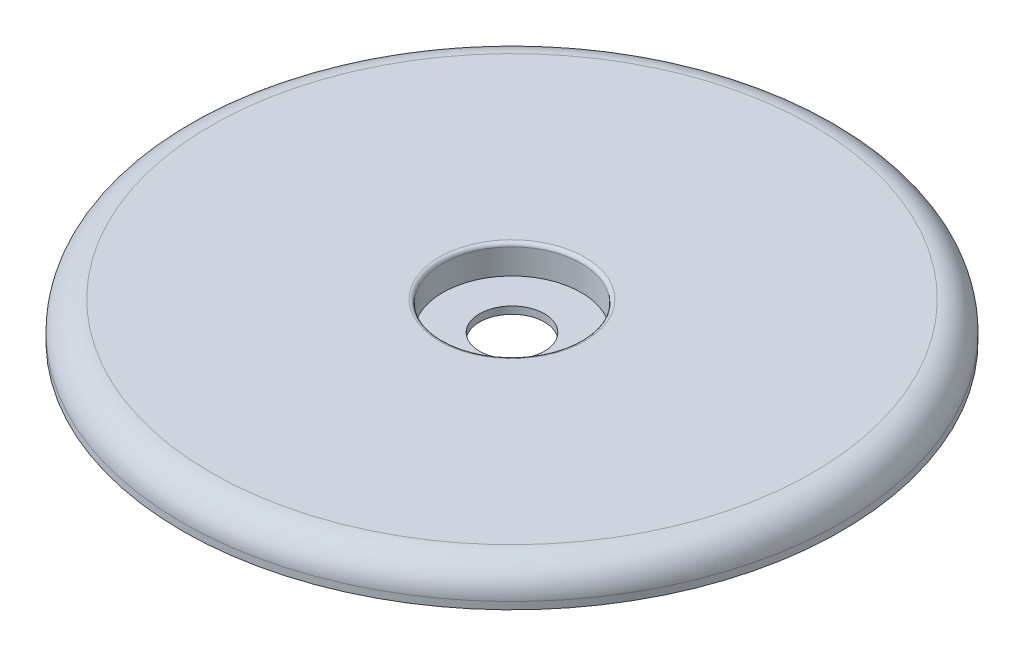
from build123d import *

# Parameters (mm, degrees)
SKETCH1_R           = 45.72
BOSS_EXTRUDE1_DEPTH = 5
SKETCH2_R           = 9.6
SKETCH2_R_2         = 4.5
CUT_EXTRUDE1_DEPTH  = 4
SKETCH3_R           = 4.5
CUT_EXTRUDE2_DEPTH  = 65.781454136
FILLET1_R           = 4
FILLET2_R           = 0.5


with BuildPart() as part:
    # Sketch1 → Boss-Extrude1 (new body)
    with BuildSketch(Plane(origin=(0, 0, 0), x_dir=(1, 0, 0), z_dir=(0, 1, 0))):
        with Locations(Location((0, 0, 0), (0, 0, 270))):
            Circle(SKETCH1_R)
    extrude(amount=BOSS_EXTRUDE1_DEPTH)

    # Sketch2 → Cut-Extrude1 (cut)
    # profile 1 of 2: a face of its own
    with BuildSketch(Plane(origin=(0, 5, 0), x_dir=(1, 0, 0), z_dir=(0, 1, 0))):
        with Locations(Location((0, 0, 0), (0, 0, 270))):
            Circle(SKETCH2_R)
        Circle(SKETCH2_R_2, mode=Mode.SUBTRACT)
    # profile 2 of 2: a face of its own
    with BuildSketch(Plane(origin=(0, 5, 0), x_dir=(1, 0, 0), z_dir=(0, 1, 0))):
        Circle(SKETCH2_R_2)
    extrude(amount=-CUT_EXTRUDE1_DEPTH, mode=Mode.SUBTRACT)

    # Sketch3 → Cut-Extrude2 (cut, through all)
    with BuildSketch(Plane(origin=(0, 1, 0), x_dir=(1, 0, 0), z_dir=(0, 1, 0))):
        with Locations(Location((0, 0, 0), (0, 0, 270))):
            Circle(SKETCH3_R)
    extrude(amount=-CUT_EXTRUDE2_DEPTH, mode=Mode.SUBTRACT)

    # Fillet1
    fillet1_edges = [part.edges().sort_by_distance(p)[0] for p in [
        (0, 5, -45.72),
    ]]
    fillet(fillet1_edges, radius=FILLET1_R)

    # Fillet2
    fillet2_edges = [part.edges().sort_by_distance(p)[0] for p in [
        (0, 5, -9.6),
    ]]
    fillet(fillet2_edges, radius=FILLET2_R)


solid = part.part
